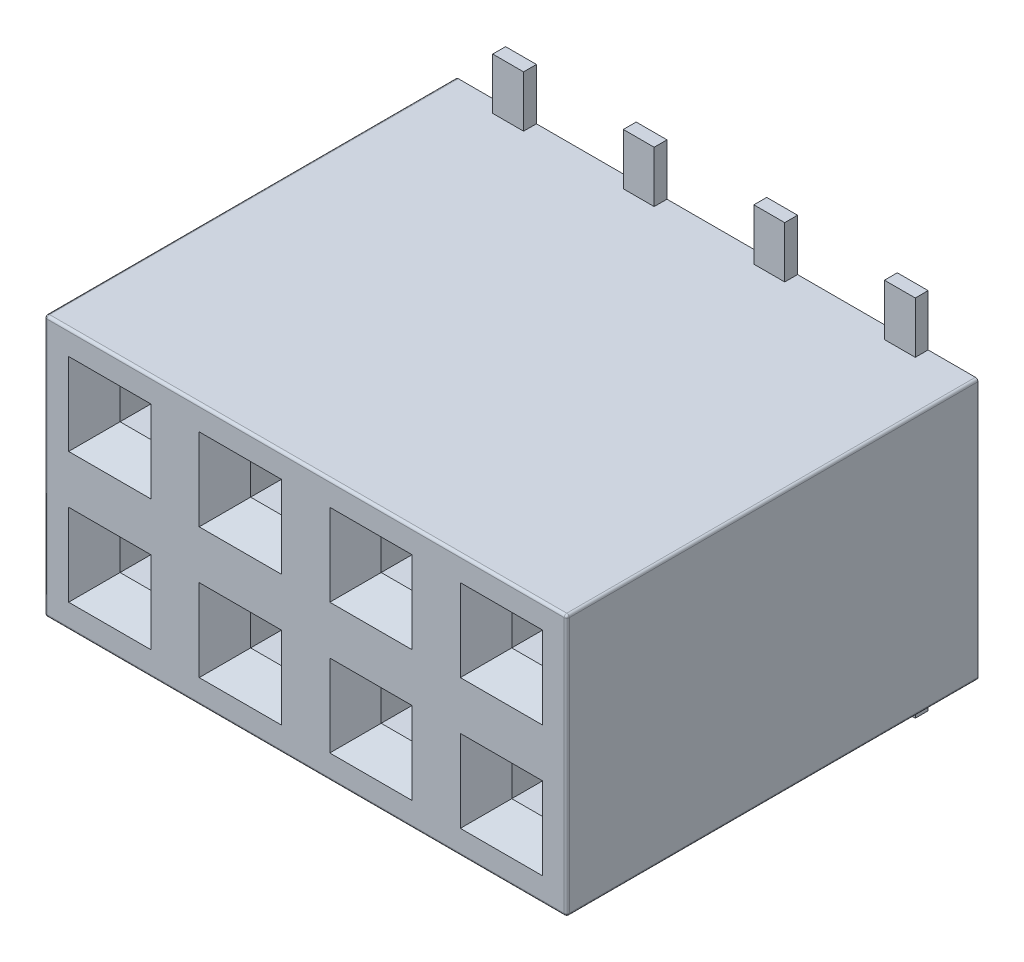
from build123d import *

# Parameters (mm, degrees)
SKETCH_1_W               = 10.16
SKETCH_1_H               = 5.08
EXTRUDE_1_DEPTH          = 8
SKETCH_2_W               = 0.6
SKETCH_2_H               = 0.6
CUT_EXTRUDE_1_DEPTH      = 10.811116144
CHAMFER_1_SIZE           = 0.5
CHAMFER_2_SIZE           = 0.5
FILLET_1_R               = 0.05
SKETCH_4_W               = 0.6
SKETCH_4_H               = 0.25
EXTRUDE_3_DEPTH          = 1
PATTERN_LINEAR_2_COUNT   = 4
PATTERN_LINEAR_2_PITCH   = 2.54
MIRROR_1_COPY_1_SKETCH_W = 0.6
MIRROR_1_COPY_1_SKETCH_H = 0.25
MIRROR_1_COPY_1_DEPTH    = 1
MIRROR_1_COPY_2_SKETCH_W = 0.6
MIRROR_1_COPY_2_SKETCH_H = 0.25
MIRROR_1_COPY_2_DEPTH    = 1
MIRROR_1_COPY_3_SKETCH_W = 0.6
MIRROR_1_COPY_3_SKETCH_H = 0.25
MIRROR_1_COPY_3_DEPTH    = 1


with BuildPart() as part:
    # 草图1 → 凸台-拉伸1 (new body)
    with BuildSketch(Plane.XY):
        Rectangle(SKETCH_1_W, SKETCH_1_H)
    extrude(amount=EXTRUDE_1_DEPTH)

    # 草图2 → 切除-拉伸1 (cut, through all)
    with BuildSketch(Plane.XY.offset(8)):
        with Locations((1.27, 1.27)):
            Rectangle(SKETCH_2_W, SKETCH_2_H)
        with Locations((-1.27, 1.27)):
            Rectangle(SKETCH_2_W, SKETCH_2_H)
        with Locations((3.81, 1.27)):
            Rectangle(SKETCH_2_W, SKETCH_2_H)
        with Locations((-1.27, -1.27)):
            Rectangle(SKETCH_2_W, SKETCH_2_H)
        with Locations((1.27, -1.27)):
            Rectangle(SKETCH_2_W, SKETCH_2_H)
        with Locations((3.81, -1.27)):
            Rectangle(SKETCH_2_W, SKETCH_2_H)
        with Locations((-3.81, -1.27)):
            Rectangle(SKETCH_2_W, SKETCH_2_H)
        with Locations((-3.81, 1.27)):
            Rectangle(SKETCH_2_W, SKETCH_2_H)
    extrude(amount=-CUT_EXTRUDE_1_DEPTH, mode=Mode.SUBTRACT)

    # 倒角1
    chamfer_1_edges = [part.edges().sort_by_distance(p)[0] for p in [
        (-3.81, 1.57, 0),
        (-3.51, 1.27, 0),
        (-3.81, 0.97, 0),
        (-4.11, 1.27, 0),
        (-0.97, 1.27, 0),
        (-1.27, 0.97, 0),
        (-1.57, 1.27, 0),
        (-1.27, 1.57, 0),
        (1.57, 1.27, 0),
        (1.27, 0.97, 0),
        (0.97, 1.27, 0),
        (1.27, 1.57, 0),
        (-3.81, -0.97, 0),
        (-3.51, -1.27, 0),
        (-3.81, -1.57, 0),
        (-4.11, -1.27, 0),
        (4.11, 1.27, 0),
        (3.81, 0.97, 0),
        (3.51, 1.27, 0),
        (3.81, 1.57, 0),
        (-0.97, -1.27, 0),
        (-1.27, -1.57, 0),
        (-1.57, -1.27, 0),
        (-1.27, -0.97, 0),
        (1.57, -1.27, 0),
        (1.27, -1.57, 0),
        (0.97, -1.27, 0),
        (1.27, -0.97, 0),
        (4.11, -1.27, 0),
        (3.81, -1.57, 0),
        (3.51, -1.27, 0),
        (3.81, -0.97, 0),
        (4.11, -1.27, 8),
        (3.81, -0.97, 8),
        (3.51, -1.27, 8),
        (3.81, -1.57, 8),
    ]]
    chamfer(chamfer_1_edges, length=CHAMFER_1_SIZE)

    # 倒角2
    chamfer_2_edges = [part.edges().sort_by_distance(p)[0] for p in [
        (-3.81, 1.57, 8),
        (-4.11, 1.27, 8),
        (-3.81, 0.97, 8),
        (-3.51, 1.27, 8),
        (-0.97, 1.27, 8),
        (-1.27, 1.57, 8),
        (-1.57, 1.27, 8),
        (-1.27, 0.97, 8),
        (1.57, 1.27, 8),
        (1.27, 1.57, 8),
        (0.97, 1.27, 8),
        (1.27, 0.97, 8),
        (-3.81, -0.97, 8),
        (-4.11, -1.27, 8),
        (-3.81, -1.57, 8),
        (-3.51, -1.27, 8),
        (4.11, 1.27, 8),
        (3.81, 1.57, 8),
        (3.51, 1.27, 8),
        (3.81, 0.97, 8),
        (-0.97, -1.27, 8),
        (-1.27, -0.97, 8),
        (-1.57, -1.27, 8),
        (-1.27, -1.57, 8),
        (1.57, -1.27, 8),
        (1.27, -0.97, 8),
        (0.97, -1.27, 8),
        (1.27, -1.57, 8),
    ]]
    chamfer(chamfer_2_edges, length=CHAMFER_2_SIZE)

    # 圆角1
    fillet_1_edges = [part.edges().sort_by_distance(p)[0] for p in [
        (-5.08, 0, 8),
        (0, -2.54, 8),
        (5.08, 0, 8),
        (0, 2.54, 8),
        (5.08, -2.54, 4),
        (-5.08, -2.54, 4),
        (-5.08, 2.54, 4),
        (5.08, 2.54, 4),
    ]]
    fillet(fillet_1_edges, radius=FILLET_1_R)

    # 草图4 → 凸台-拉伸3 (add)
    with BuildSketch(Plane(origin=(0, 2.54, 0), x_dir=(1, 0, 0), z_dir=(0, 1, 0))):
        with Locations((-3.81, -0.125)):
            Rectangle(SKETCH_4_W, SKETCH_4_H)
    extrude_3 = extrude(amount=EXTRUDE_3_DEPTH)

    # 阵列(线性)2: 凸台-拉伸3 ×4
    with Locations(*[(i * PATTERN_LINEAR_2_PITCH, 0, 0) for i in range(1, PATTERN_LINEAR_2_COUNT)]):
        add(extrude_3)

    # 镜向1: 凸台-拉伸3 across plane
    add(extrude_3.mirror(Plane.ZX))

    # 镜向1 copy 1 sketch → 镜向1 copy 1 (add)
    with BuildSketch(Plane(origin=(2.54, -2.54, 0), x_dir=(1, 0, 0), z_dir=(0, -1, 0))):
        with Locations((-3.81, 0.125)):
            Rectangle(MIRROR_1_COPY_1_SKETCH_W, MIRROR_1_COPY_1_SKETCH_H)
    extrude(amount=MIRROR_1_COPY_1_DEPTH)

    # 镜向1 copy 2 sketch → 镜向1 copy 2 (add)
    with BuildSketch(Plane(origin=(5.08, -2.54, 0), x_dir=(1, 0, 0), z_dir=(0, -1, 0))):
        with Locations((-3.81, 0.125)):
            Rectangle(MIRROR_1_COPY_2_SKETCH_W, MIRROR_1_COPY_2_SKETCH_H)
    extrude(amount=MIRROR_1_COPY_2_DEPTH)

    # 镜向1 copy 3 sketch → 镜向1 copy 3 (add)
    with BuildSketch(Plane(origin=(7.62, -2.54, 0), x_dir=(1, 0, 0), z_dir=(0, -1, 0))):
        with Locations((-3.81, 0.125)):
            Rectangle(MIRROR_1_COPY_3_SKETCH_W, MIRROR_1_COPY_3_SKETCH_H)
    extrude(amount=MIRROR_1_COPY_3_DEPTH)


solid = part.part
